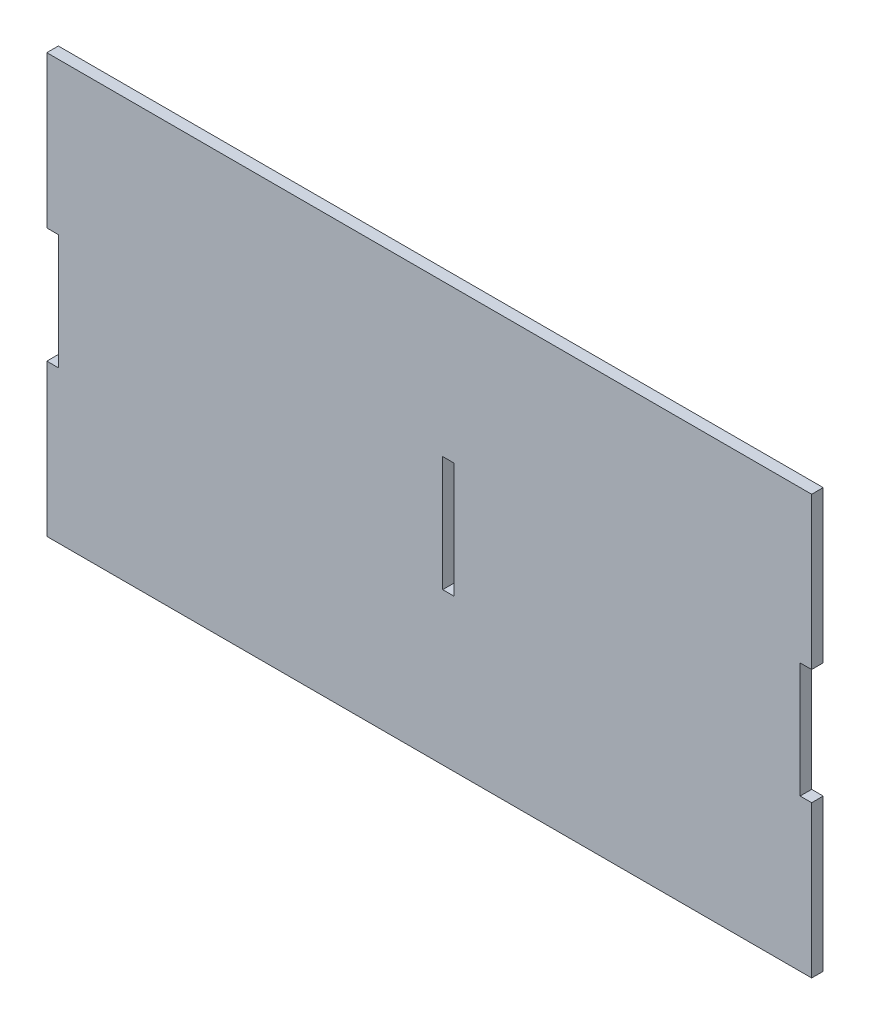
from build123d import *

# Parameters (mm, degrees)
SKETCH1_W           = 3
SKETCH1_H           = 30
BOSS_EXTRUDE1_DEPTH = 3


with BuildPart() as part:
    # Sketch1 → Boss-Extrude1 (new body)
    with BuildSketch(Plane.XY):
        Polygon((858, 109), (659, 109), (659, 69.5), (662, 69.5), (662, 39.5), (659, 39.5), (659, 0), (858, 0), (858, 39.5), (855, 39.5), (855, 69.5), (858, 69.5), align=None)
        with Locations((763.5, 54.5)):
            Rectangle(SKETCH1_W, SKETCH1_H, mode=Mode.SUBTRACT)
    extrude(amount=BOSS_EXTRUDE1_DEPTH)


solid = part.part
